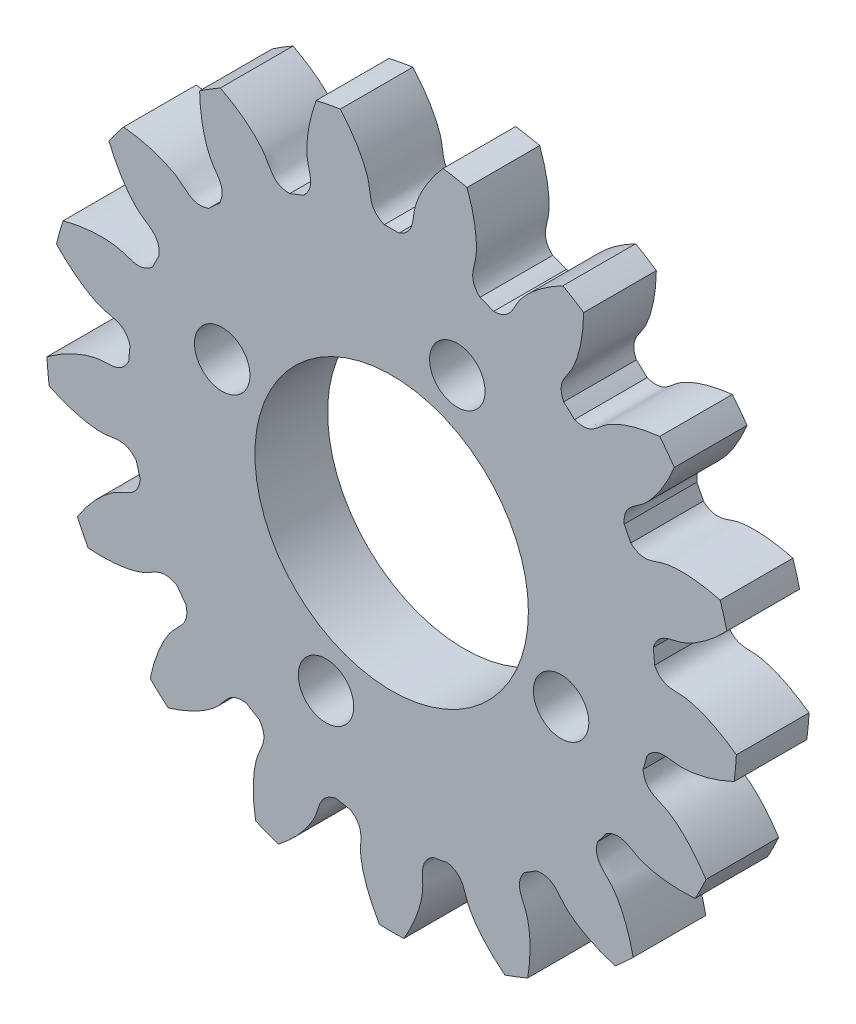
from build123d import *

# Parameters (mm, degrees)
SKETCH_1_R               = 19
EXTRUDE_1_DEPTH          = 4
CUT_EXTRUDE_1_DEPTH      = 28.166155414
PATTERN_CIRCULAR_1_COUNT = 17
SKETCH_4_R               = 7.525
SKETCH_4_R_2             = 1.525
CUT_EXTRUDE_2_DEPTH      = 10


with BuildPart() as part:
    # 草图1 → 凸台-拉伸1 (new body)
    with BuildSketch(Plane.XY):
        Circle(SKETCH_1_R)
    extrude(amount=EXTRUDE_1_DEPTH)

    # 草图2 → 切除-拉伸1 (cut, through all)
    with BuildSketch(Plane.XY):
        with BuildLine():
            ThreePointArc((0.403387494, 14.494387829), (0, 14.5), (-0.403387494, 14.494387829))
            add(Edge.make_bspline(
                [(-0.403387494, 14.494387829), (-1.255759481, 14.849644042), (-1.132390756, 15.509626813), (-1.276611209, 16.129648275), (-1.289951469, 16.18230119), (-1.306037005, 16.240838627), (-1.32510118, 16.305170665), (-1.347383555, 16.375198727), (-1.373118159, 16.450817515), (-1.40253689, 16.531914502), (-1.435868224, 16.618370188), (-1.473337358, 16.710058129), (-1.515165928, 16.80684504), (-1.561571855, 16.908590882), (-1.612769151, 17.015148962), (-1.66896775, 17.12636603), (-1.730373323, 17.242082389), (-1.797187111, 17.362132), (-1.869605751, 17.4863426), (-1.947821109, 17.61453582), (-2.032020115, 17.746527309), (-2.1223846, 17.882126855), (-2.219091138, 18.021138524), (-2.32231089, 18.163360791), (-2.432209452, 18.308586678), (-2.548946705, 18.456603899), (-2.67267667, 18.607195006), (-2.803547366, 18.760137539), (-2.941700674, 18.915204179), (-3.087272199, 19.072162909), (-3.24039114, 19.23077717), (-3.401180166, 19.390806026), (-3.569755292, 19.552004336), (-3.746225758, 19.71412292), (-3.930693918, 19.876908731), (-4.123255131, 20.040105038), (-4.323997649, 20.203451599), (-4.533002522, 20.366684847), (-4.750343497, 20.529538073), (-4.976086928, 20.691741613), (-5.210291694, 20.853023038), (-5.453009069, 21.013107349), (-5.79164327, 21.226861067), (-6.053153804, 21.381051942), (-6.231291666, 21.481438237)],
                knots=[0, 0, 0, 0, 0.193882922, 0.199023975, 0.204850501, 0.211362501, 0.218559975, 0.226442923, 0.235011345, 0.24426524, 0.254204608, 0.264829451, 0.276139767, 0.288135557, 0.300816821, 0.314183558, 0.328235769, 0.342973453, 0.358396612, 0.374505244, 0.39129935, 0.408778929, 0.426943982, 0.445794509, 0.46533051, 0.485551984, 0.506458932, 0.528051354, 0.550329249, 0.573292619, 0.596941461, 0.621275778, 0.646295568, 0.672000832, 0.69839157, 0.725467781, 0.753229466, 0.781676625, 0.810809257, 0.840627364, 0.871130943, 0.902319997, 0.934194524, 1, 1, 1, 1], degree=3))
            ThreePointArc((-6.231291666, 21.481438237), (0, 22.366966369), (6.231291666, 21.481438237))
            add(Edge.make_bspline(
                [(0.403387494, 14.494387829), (1.255759481, 14.849644042), (1.132390756, 15.509626813), (1.276611209, 16.129648275), (1.289951469, 16.18230119), (1.306037005, 16.240838627), (1.32510118, 16.305170665), (1.347383555, 16.375198727), (1.373118159, 16.450817515), (1.40253689, 16.531914502), (1.435868224, 16.618370188), (1.473337358, 16.710058129), (1.515165928, 16.80684504), (1.561571855, 16.908590882), (1.612769151, 17.015148962), (1.66896775, 17.12636603), (1.730373323, 17.242082389), (1.797187111, 17.362132), (1.869605751, 17.4863426), (1.947821109, 17.61453582), (2.032020115, 17.746527309), (2.1223846, 17.882126855), (2.219091138, 18.021138524), (2.32231089, 18.163360791), (2.432209452, 18.308586678), (2.548946705, 18.456603899), (2.67267667, 18.607195006), (2.803547366, 18.760137539), (2.941700674, 18.915204179), (3.087272199, 19.072162909), (3.24039114, 19.23077717), (3.401180166, 19.390806026), (3.569755292, 19.552004336), (3.746225758, 19.71412292), (3.930693918, 19.876908731), (4.123255131, 20.040105038), (4.323997649, 20.203451599), (4.533002522, 20.366684847), (4.750343497, 20.529538073), (4.976086928, 20.691741613), (5.210291694, 20.853023038), (5.453009069, 21.013107349), (5.79164327, 21.226861067), (6.053153804, 21.381051942), (6.231291666, 21.481438237)],
                knots=[0, 0, 0, 0, 0.193882922, 0.199023975, 0.204850501, 0.211362501, 0.218559975, 0.226442923, 0.235011345, 0.24426524, 0.254204608, 0.264829451, 0.276139767, 0.288135557, 0.300816821, 0.314183558, 0.328235769, 0.342973453, 0.358396612, 0.374505244, 0.39129935, 0.408778929, 0.426943982, 0.445794509, 0.46533051, 0.485551984, 0.506458932, 0.528051354, 0.550329249, 0.573292619, 0.596941461, 0.621275778, 0.646295568, 0.672000832, 0.69839157, 0.725467781, 0.753229466, 0.781676625, 0.810809257, 0.840627364, 0.871130943, 0.902319997, 0.934194524, 1, 1, 1, 1], degree=3))
        make_face()
    cut_extrude_1 = extrude(amount=CUT_EXTRUDE_1_DEPTH, mode=Mode.SUBTRACT)

    # 阵列(圆周)1: 切除-拉伸1 ×17 about axis
    pattern_circular_1_axis = Axis((0, 0, 4), (0, 0, -1))
    for i in range(1, PATTERN_CIRCULAR_1_COUNT):
        add(cut_extrude_1.rotate(pattern_circular_1_axis, i * 360 / PATTERN_CIRCULAR_1_COUNT), mode=Mode.SUBTRACT)

    # 草图4 → 切除-拉伸2 (cut)
    with BuildSketch(Plane.XY.offset(4)):
        Circle(SKETCH_4_R)
        with Locations((3.612416662, 9.324722294)):
            Circle(SKETCH_4_R_2)
        with Locations((9.324722294, -3.612416662)):
            Circle(SKETCH_4_R_2)
        with Locations((-3.612416662, -9.324722294)):
            Circle(SKETCH_4_R_2)
        with Locations((-9.324722294, 3.612416662)):
            Circle(SKETCH_4_R_2)
    extrude(amount=-CUT_EXTRUDE_2_DEPTH, mode=Mode.SUBTRACT)


solid = part.part
